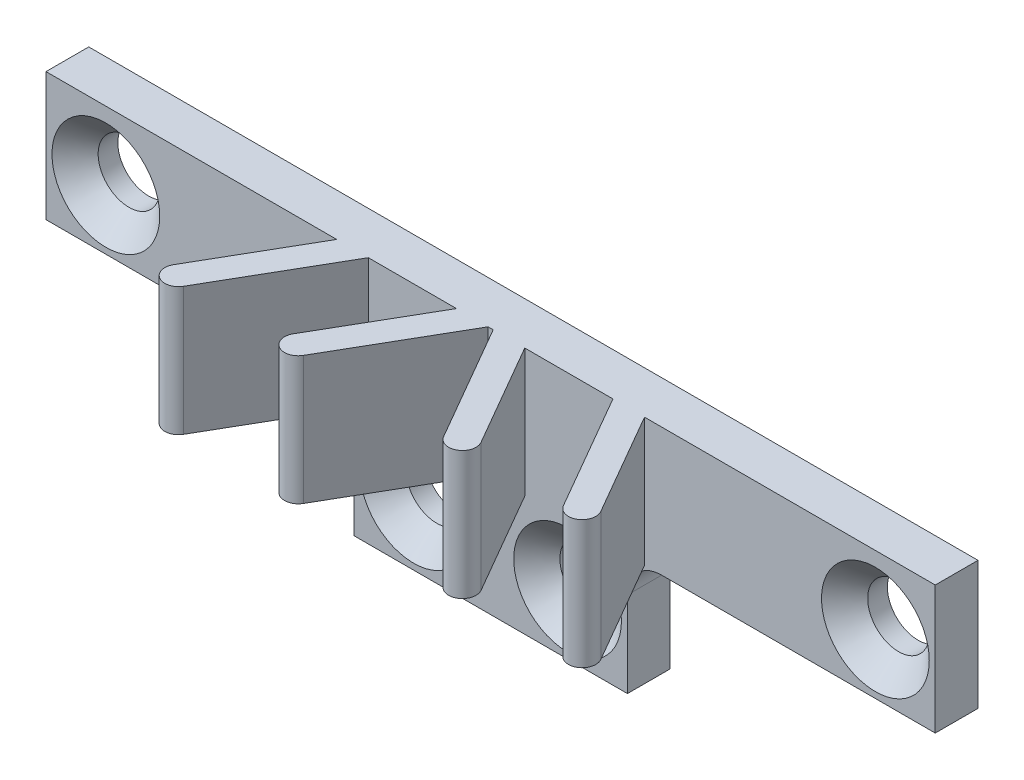
from build123d import *

# Parameters (mm, degrees)
BOSS_EXTRUDE1_DEPTH                                 = 5
SKETCH2_W                                           = 16
SKETCH2_H                                           = 7
SKETCH2_W_2                                         = 7
SKETCH2_H_2                                         = 7.5
CUT_EXTRUDE1_DEPTH                                  = 7.5
CSK_FOR_M3_COUNTERSUNK_FLAT_HEAD_SCREW1_D           = 3.6
CSK_FOR_M3_COUNTERSUNK_FLAT_HEAD_SCREW1_DEPTH       = 5
CSK_FOR_M3_COUNTERSUNK_FLAT_HEAD_SCREW1_CSINK_D     = 6.3
CSK_FOR_M3_COUNTERSUNK_FLAT_HEAD_SCREW1_CSINK_ANGLE = 90
CSK_FOR_M3_COUNTERSUNK_FLAT_HEAD_SCREW1_TIP         = 1.081549114
FILLET1_R                                           = 2
CUT_EXTRUDE2_DEPTH                                  = 7.5


with BuildPart() as part:
    # Sketch1 → Boss-Extrude1 (new, symmetric)
    with BuildSketch(Plane.XY):
        Polygon((26, 7.25), (26, -0.25), (8, -0.25), (8, -7.25), (-8, -7.25), (-8, -0.25), (-26, -0.25), (-26, 7.25), align=None)
    extrude(amount=BOSS_EXTRUDE1_DEPTH, both=True)

    # Sketch2 → Cut-Extrude1 (cut)
    with BuildSketch(Plane.XY.offset(5)):
        with Locations((0, -3.75)):
            Rectangle(SKETCH2_W, SKETCH2_H)
        with Locations((22.5, 3.5)):
            Rectangle(SKETCH2_W_2, SKETCH2_H_2)
        with Locations((-22.5, 3.5)):
            Rectangle(SKETCH2_W_2, SKETCH2_H_2)
    extrude(amount=-CUT_EXTRUDE1_DEPTH, mode=Mode.SUBTRACT)

    # CSK for M3 Countersunk Flat Head Screw1
    with Locations(Plane.XY.offset(-2.5)):
        with Locations((-4.5, -3.75), (4.5, -3.75), (-22.5, 3.25), (22.5, 3.25)):
            CounterSinkHole(CSK_FOR_M3_COUNTERSUNK_FLAT_HEAD_SCREW1_D / 2, CSK_FOR_M3_COUNTERSUNK_FLAT_HEAD_SCREW1_CSINK_D / 2, depth=CSK_FOR_M3_COUNTERSUNK_FLAT_HEAD_SCREW1_DEPTH, counter_sink_angle=CSK_FOR_M3_COUNTERSUNK_FLAT_HEAD_SCREW1_CSINK_ANGLE)
            with Locations((0, 0, -(CSK_FOR_M3_COUNTERSUNK_FLAT_HEAD_SCREW1_DEPTH + CSK_FOR_M3_COUNTERSUNK_FLAT_HEAD_SCREW1_TIP / 2))):  # 118° drill point
                Cone(0, CSK_FOR_M3_COUNTERSUNK_FLAT_HEAD_SCREW1_D / 2, CSK_FOR_M3_COUNTERSUNK_FLAT_HEAD_SCREW1_TIP, mode=Mode.SUBTRACT)

    # Fillet1
    fillet1_edges = [part.edges().sort_by_distance(p)[0] for p in [
        (8, -0.25, -3.75),
        (-8, -0.25, -3.75),
    ]]
    fillet(fillet1_edges, radius=FILLET1_R)

    # Sketch6 → Cut-Extrude2 (cut)
    with BuildSketch(Plane(origin=(0, 7.25, 0), x_dir=(1, 0, 0), z_dir=(0, 1, 0))):
        with BuildLine():
            Line((13.330127019, -5), (11.482606158, -5))
            Line((11.482606158, -5), (4.480127019, -5))
            Line((4.480127019, -5), (-19, -5))
            Line((-19, -5), (-19, 2.5))
            Line((-19, 2.5), (-9, 2.5))
            Line((-9, 2.5), (-12.493246804, -3.550480947))
            ThreePointArc((-12.493246804, -3.550480947), (-12.200426481, -4.64330127), (-11.107606158, -4.350480947))
            Line((-11.107606158, -4.350480947), (-7.152479139, 2.5))
            Line((-7.152479139, 2.5), (-1.997520861, 2.5))
            Line((-1.997520861, 2.5), (-5.490767665, -3.550480947))
            ThreePointArc((-5.490767665, -3.550480947), (-5.197947342, -4.64330127), (-4.105127019, -4.350480947))
            Line((-4.105127019, -4.350480947), (-0.15, 2.5))
            Line((-0.15, 2.5), (0.15, 2.5))
            Line((0.15, 2.5), (4.105127019, -4.350480947))
            ThreePointArc((4.105127019, -4.350480947), (5.197947342, -4.64330127), (5.490767665, -3.550480947))
            Line((5.490767665, -3.550480947), (1.997520861, 2.5))
            Line((1.997520861, 2.5), (7.152479139, 2.5))
            Line((7.152479139, 2.5), (11.107606158, -4.350480947))
            ThreePointArc((11.107606158, -4.350480947), (12.200426481, -4.64330127), (12.493246804, -3.550480947))
            Line((12.493246804, -3.550480947), (9, 2.5))
            Line((9, 2.5), (19, 2.5))
            Line((19, 2.5), (19, -5))
            Line((19, -5), (13.330127019, -5))
        make_face()
    extrude(amount=-CUT_EXTRUDE2_DEPTH, mode=Mode.SUBTRACT)


solid = part.part
